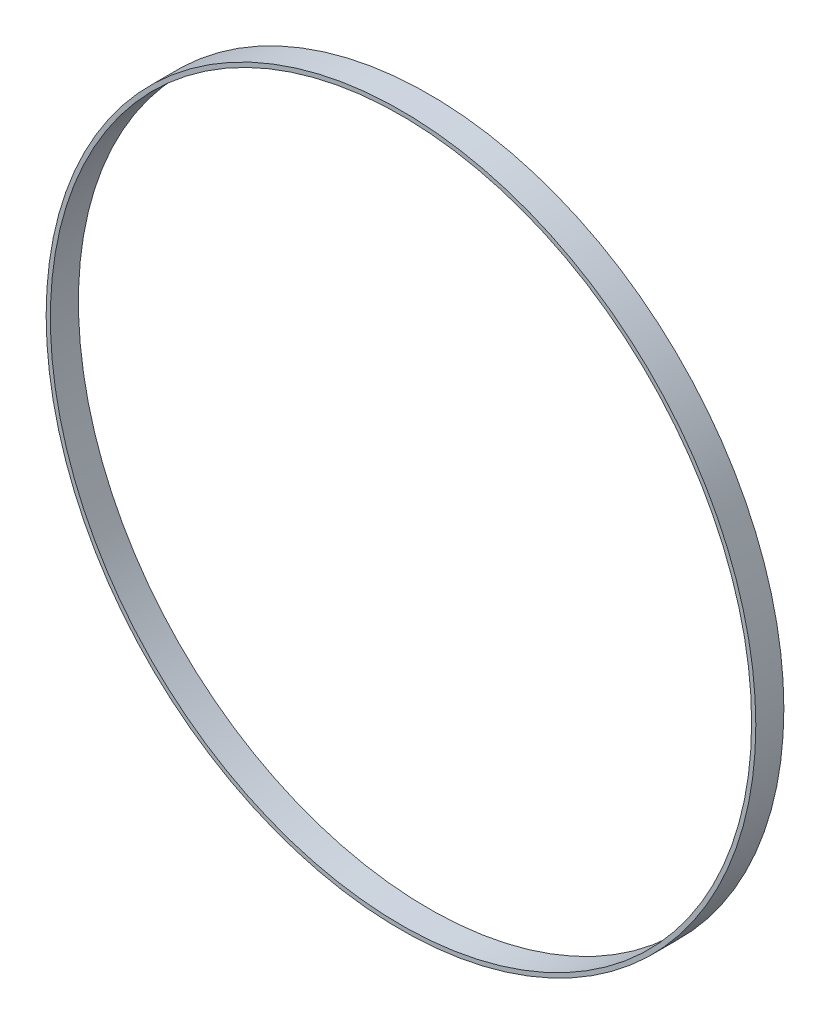
from build123d import *

# Parameters (mm, degrees)
SKETCH1_R           = 253
SKETCH1_R_2         = 250
BOSS_EXTRUDE1_DEPTH = 20


with BuildPart() as part:
    # Sketch1 → Boss-Extrude1 (new body)
    with BuildSketch(Plane.XY):
        Circle(SKETCH1_R)
        Circle(SKETCH1_R_2, mode=Mode.SUBTRACT)
    extrude(amount=BOSS_EXTRUDE1_DEPTH)


solid = part.part
